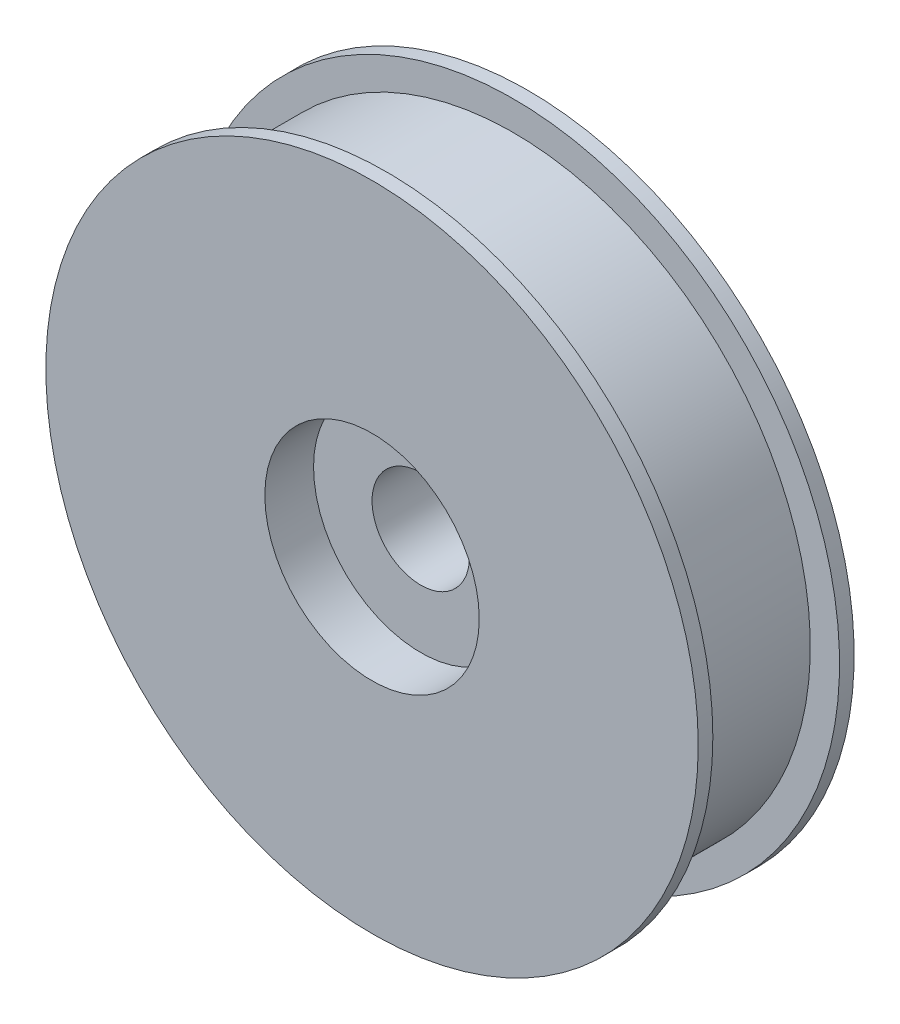
from build123d import *

# Parameters (mm, degrees)
SKETCH_1_R          = 30.47
EXTRUDE_1_DEPTH     = 13
SKETCH_2_R          = 33.47
EXTRUDE_2_DEPTH     = 1.5
EXTRUDE_START       = 1.5
SKETCH_3_R          = 33.47
EXTRUDE_3_DEPTH     = 1.5
SKETCH_4_R          = 5
CUT_EXTRUDE_1_DEPTH = 50.964805614
SKETCH_5_R          = 11
CUT_EXTRUDE_2_DEPTH = 5


with BuildPart() as part:
    # 草图1 → 凸台-拉伸1 (new body)
    with BuildSketch(Plane.XY):
        with Locations(Location((0, 0, 0), (0, 0, 180))):
            Circle(SKETCH_1_R)
    extrude(amount=EXTRUDE_1_DEPTH)

    # 草图2 → 凸台-拉伸2 (add)
    with BuildSketch(Plane.XY.offset(13)):
        Circle(SKETCH_2_R)
    extrude(amount=EXTRUDE_2_DEPTH)

    # 草图3 → 凸台-拉伸3 (add)
    with BuildSketch(Plane(origin=(0, 0, 0), x_dir=(-1, 0, 0), z_dir=(0, 0, -1)).offset(EXTRUDE_START)):
        with Locations(Location((0, 0, 0), (0, 0, 180))):
            Circle(SKETCH_3_R)
    extrude(amount=-EXTRUDE_3_DEPTH)

    # 草图4 → 切除-拉伸1 (cut, through all)
    with BuildSketch(Plane.XY.offset(14.5)):
        Circle(SKETCH_4_R)
    extrude(amount=-CUT_EXTRUDE_1_DEPTH, mode=Mode.SUBTRACT)

    # 草图5 → 切除-拉伸2 (cut)
    with BuildSketch(Plane.XY.offset(14.5)):
        Circle(SKETCH_5_R)
    extrude(amount=-CUT_EXTRUDE_2_DEPTH, mode=Mode.SUBTRACT)


solid = part.part
